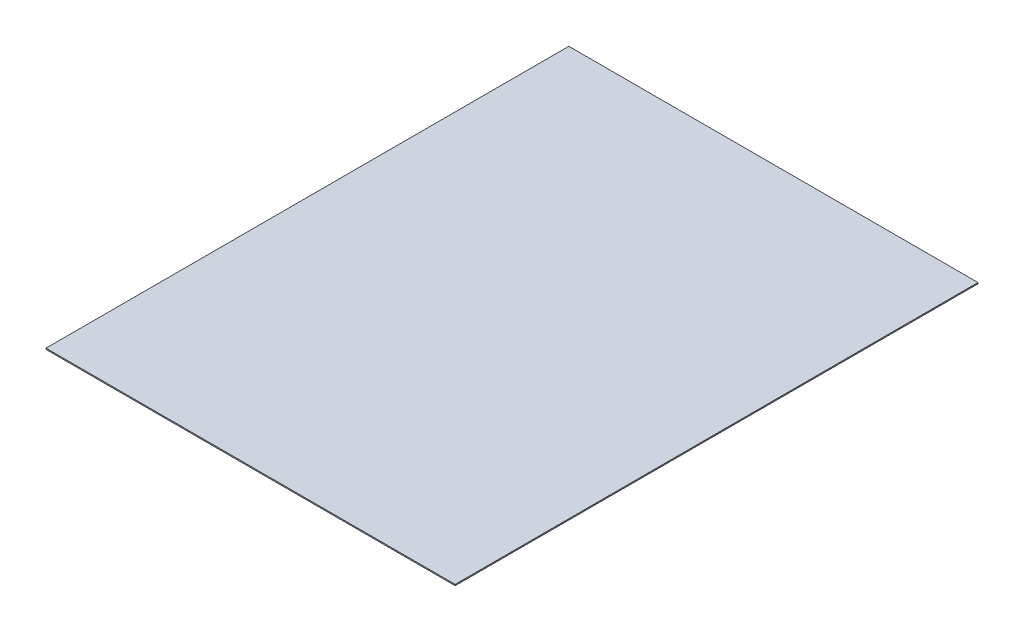
from build123d import *

# Parameters (mm, degrees)
CROQUIS1_W      = 360
CROQUIS1_H      = 460
DAR_ESPESOR2_T1 = 1


with BuildPart() as body_1:
    # Croquis1 → Superficie-Plano2: a flat surface bounded by the sketch
    with BuildSketch(Plane(origin=(0, 0, 0), x_dir=(1, 0, 0), z_dir=(0, 1, 0)), mode=Mode.PRIVATE) as superficie_plano2_1_region:
        Rectangle(CROQUIS1_W, CROQUIS1_H)
    superficie_plano2_1 = superficie_plano2_1_region.sketch.faces()[0]
    add(Solid.thicken(superficie_plano2_1, DAR_ESPESOR2_T1))


solid = body_1.part
